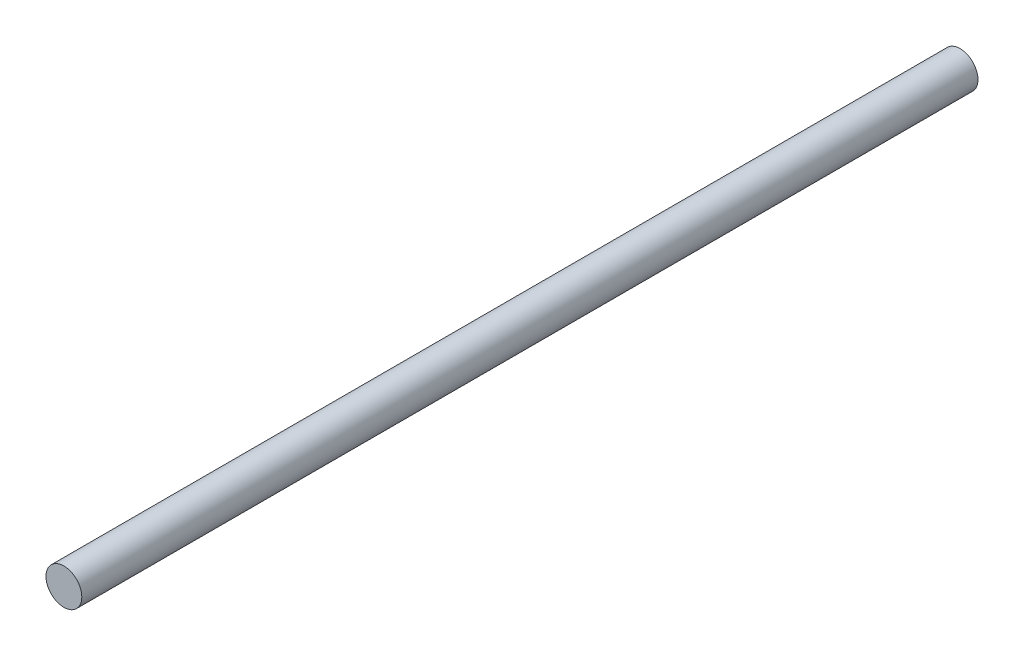
from build123d import *

# Parameters (mm, degrees)
SKETCH1_R           = 8
BOSS_EXTRUDE2_DEPTH = 400


with BuildPart() as part:
    # Sketch1 → Boss-Extrude2 (new body)
    with BuildSketch(Plane.XY):
        Circle(SKETCH1_R)
    extrude(amount=BOSS_EXTRUDE2_DEPTH)


solid = part.part
